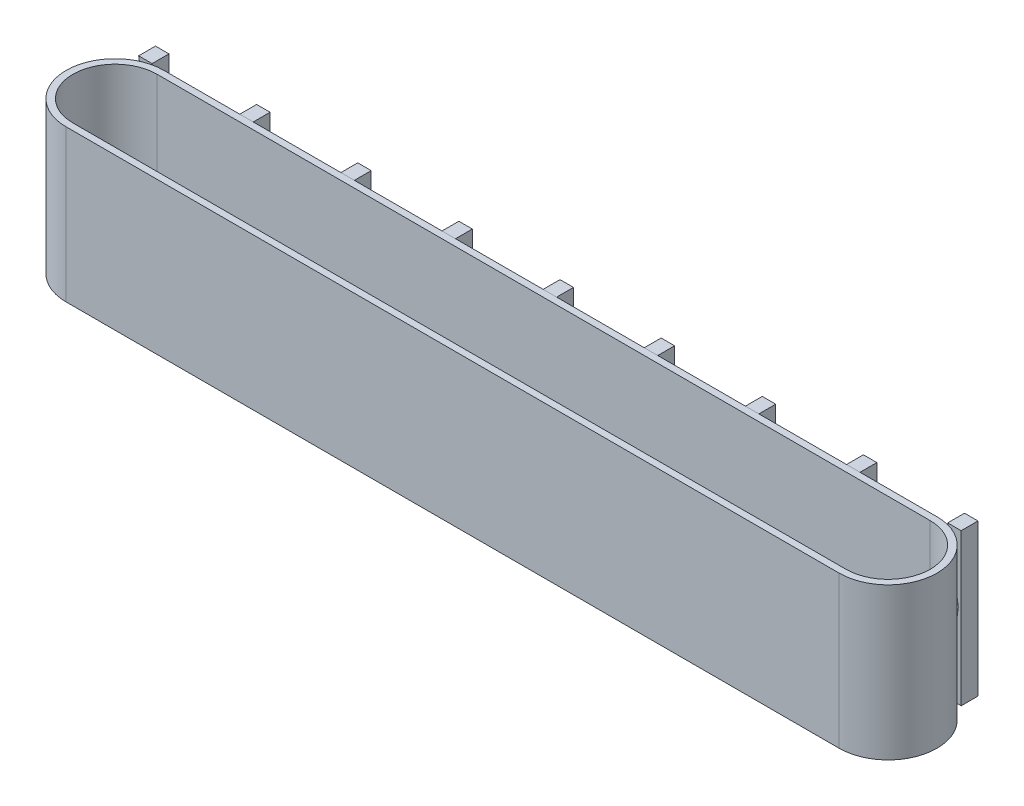
from build123d import *

# Parameters (mm, degrees)
SALIENTE_EXTRUIR1_DEPTH = 45
SALIENTE_EXTRUIR2_DEPTH = 5
MATRIZL1_COUNT          = 9
MATRIZL1_PITCH          = 30


with BuildPart() as part:
    # Croquis1 → Saliente-Extruir1 (new body)
    with BuildSketch(Plane(origin=(0, 0, 0), x_dir=(1, 0, 0), z_dir=(0, 1, 0))):
        with BuildLine():
            Line((-114.67, 14.5), (114.67, 14.5))
            ThreePointArc((114.67, 14.5), (129.17, 0), (114.67, -14.5))
            Line((114.67, -14.5), (-114.67, -14.5))
            ThreePointArc((-114.67, -14.5), (-129.17, 0), (-114.67, 14.5))
        make_face()
        with BuildLine():
            Line((-114.67, 12.5), (114.67, 12.5))
            ThreePointArc((114.67, 12.5), (127.17, 0), (114.67, -12.5))
            Line((114.67, -12.5), (-114.67, -12.5))
            ThreePointArc((-114.67, -12.5), (-127.17, 0), (-114.67, 12.5))
        make_face(mode=Mode.SUBTRACT)
    extrude(amount=SALIENTE_EXTRUIR1_DEPTH)


with BuildPart() as body_2:
    # Croquis2 → Saliente-Extruir2 (new body)
    with BuildSketch(Plane(origin=(0, 0, -14.5), x_dir=(-1, 0, 0), z_dir=(0, 0, -1))):
        Polygon((-121.840063707, 45), (-117.840063707, 45), (-120.996129756, 25), (-117.840063707, 0), (-121.840063707, 0), align=None)
    saliente_extruir2 = extrude(amount=SALIENTE_EXTRUIR2_DEPTH)


with BuildPart() as matrizl1_1:
    # MatrizL1: Saliente-Extruir2 ×9
    with Locations(*[(-i * MATRIZL1_PITCH, 0, 0) for i in range(1, MATRIZL1_COUNT)]):
        add(saliente_extruir2)


solid = Compound([part.part, body_2.part, matrizl1_1.part])
